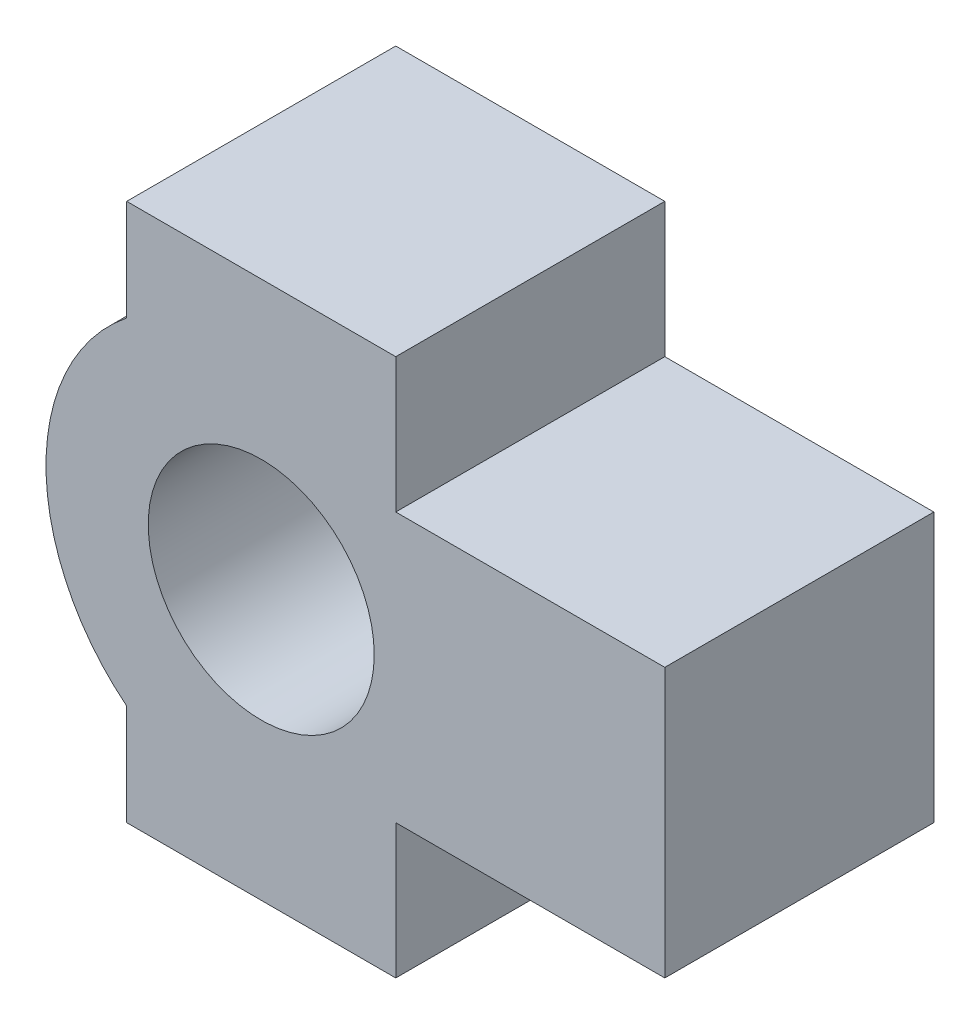
from build123d import *

# Parameters (mm, degrees)
BOSS_EXTRUDE1_DEPTH = 5
SKETCH2_R           = 2.1
CUT_EXTRUDE1_DEPTH  = 10
BOSS_EXTRUDE2_DEPTH = 5


with BuildPart() as part:
    # Sketch1 → Boss-Extrude1 (new body)
    with BuildSketch(Plane.XY):
        Polygon((-16.554054054, 7.094594595), (-21.554054054, 7.094594595), (-21.554054054, -2.905405405), (-16.554054054, -2.905405405), (-16.554054054, -0.405405405), (-11.554054054, -0.405405405), (-11.554054054, 4.594594595), (-16.554054054, 4.594594595), align=None)
    extrude(amount=BOSS_EXTRUDE1_DEPTH)

    # Sketch2 → Cut-Extrude1 (cut)
    with BuildSketch(Plane.XY.offset(5)):
        with Locations((-19.054054054, 2.094594595)):
            Circle(SKETCH2_R)
    extrude(amount=-CUT_EXTRUDE1_DEPTH, mode=Mode.SUBTRACT)

    # Sketch3 → Boss-Extrude2 (add)
    with BuildSketch(Plane.XY.offset(5)):
        with BuildLine():
            Line((-21.554054054, 5.217093594), (-21.554054054, -1.027904405))
            ThreePointArc((-21.554054054, -1.027904405), (-23.054054054, 2.094594595), (-21.554054054, 5.217093594))
        make_face()
    extrude(amount=-BOSS_EXTRUDE2_DEPTH)


solid = part.part
